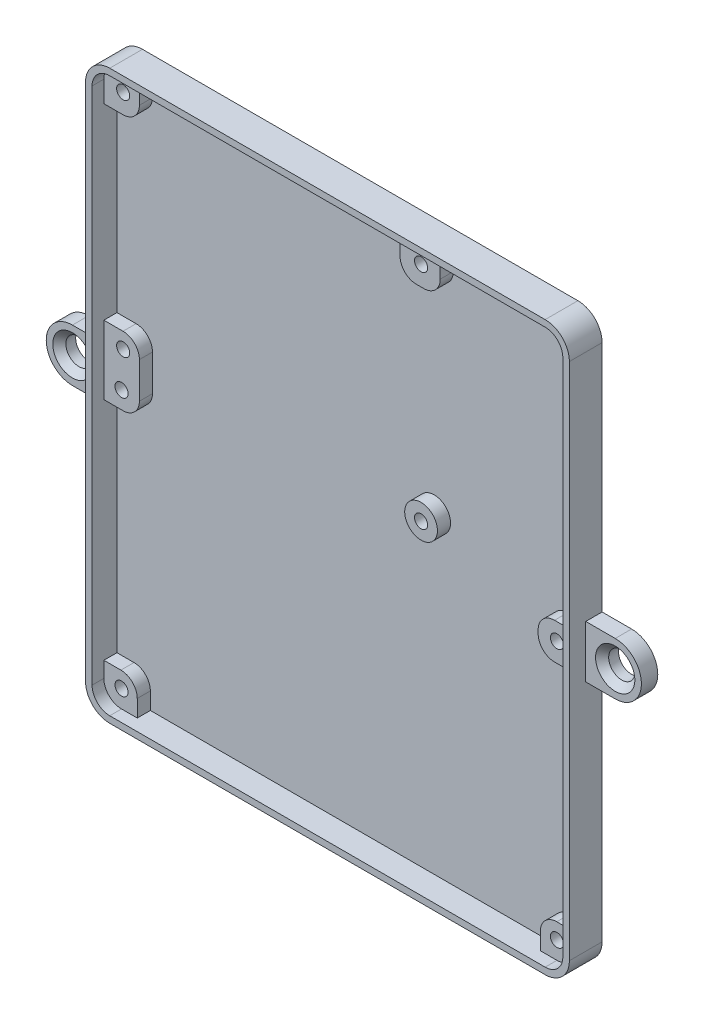
from build123d import *

# Parameters (mm, degrees)
EXTRUDE_1_DEPTH     = 1.2
EXTRUDE_2_DEPTH     = 5
SKETCH_6_R          = 2.5
EXTRUDE_3_DEPTH     = 2
SKETCH_7_R          = 1
CUT_EXTRUDE_1_DEPTH = 113.237393177
SKETCH_8_R          = 2
EXTRUDE_4_DEPTH     = 2.5
CHAMFER_1_SIZE      = 1


with BuildPart() as part:
    # Эскиз4 → Бобышка-Вытянуть1 (new body)
    with BuildSketch(Plane.XY):
        with BuildLine():
            Line((71.69999924, 81.74999906), (71.70000051, 2.500002823))
            ThreePointArc((71.70000051, 2.500002823), (70.909189394, 0.590811786), (68.99999916, -0.20000127))
            Line((68.99999916, -0.20000127), (2.50000008, -0.20000127))
            ThreePointArc((2.50000008, -0.20000127), (0.590809846, 0.590811786), (-0.20000127, 2.500002823))
            Line((-0.20000127, 2.500002823), (-0.2, 81.74999906))
            ThreePointArc((-0.2, 81.74999906), (0.590811714, 83.659187426), (2.50000008, 84.44999914))
            Line((2.50000008, 84.44999914), (68.99999916, 84.44999914))
            ThreePointArc((68.99999916, 84.44999914), (70.909187526, 83.659187426), (71.69999924, 81.74999906))
        make_face()
    extrude(amount=EXTRUDE_1_DEPTH)

    # Эскиз5 → Бобышка-Вытянуть2 (add)
    with BuildSketch(Plane.XY):
        with BuildLine():
            Line((-1.2, 81.74999906), (-1.20000127, 2.500002839))
            ThreePointArc((-1.20000127, 2.500002839), (-0.116296941, -0.116294989), (2.50000008, -1.20000127))
            Line((2.50000008, -1.20000127), (68.99999916, -1.20000127))
            ThreePointArc((68.99999916, -1.20000127), (71.616296534, -0.116294636), (72.70000051, 2.500003839))
            Line((72.70000051, 2.500003839), (72.69999924, 81.749999076))
            ThreePointArc((72.69999924, 81.749999076), (71.616294301, 84.366294213), (68.99999916, 85.44999914))
            Line((68.99999916, 85.44999914), (2.50000008, 85.44999914))
            ThreePointArc((2.50000008, 85.44999914), (-0.116295067, 84.366294207), (-1.2, 81.74999906))
        make_face()
        with BuildLine():
            Line((-0.2, 81.74999906), (-0.20000127, 2.500002823))
            ThreePointArc((-0.20000127, 2.500002823), (0.590809846, 0.590811786), (2.50000008, -0.20000127))
            Line((2.50000008, -0.20000127), (68.99999916, -0.20000127))
            ThreePointArc((68.99999916, -0.20000127), (70.909189394, 0.590811786), (71.70000051, 2.500002823))
            Line((71.70000051, 2.500002823), (71.69999924, 81.74999906))
            ThreePointArc((71.69999924, 81.74999906), (70.909187526, 83.659187426), (68.99999916, 84.44999914))
            Line((68.99999916, 84.44999914), (2.50000008, 84.44999914))
            ThreePointArc((2.50000008, 84.44999914), (0.590811714, 83.659187426), (-0.2, 81.74999906))
        make_face(mode=Mode.SUBTRACT)
    extrude(amount=EXTRUDE_2_DEPTH)

    # Эскиз6 → Бобышка-Вытянуть3 (add)
    with BuildSketch(Plane.XY.offset(1.2)):
        with Locations((48.25000002, 47.49999898)):
            Circle(SKETCH_6_R)
        with BuildLine():
            Line((2.50000008, 84.44999914), (5.226059178, 84.44999914))
            Line((5.226059178, 84.44999914), (5.226059178, 81.007828318))
            ThreePointArc((5.226059178, 81.007828318), (4.493826131, 79.240061365), (2.726059178, 78.507828318))
            Line((2.726059178, 78.507828318), (-0.200000052, 78.507828318))
            Line((-0.200000052, 78.507828318), (-0.2, 81.74999906))
            ThreePointArc((-0.2, 81.74999906), (0.590811714, 83.659187426), (2.50000008, 84.44999914))
        make_face()
        with BuildLine():
            Line((-0.20000127, 2.500002823), (-0.200001232, 4.890114712))
            Line((-0.200001232, 4.890114712), (2.403331994, 4.890114712))
            ThreePointArc((2.403331994, 4.890114712), (4.171098947, 4.157881665), (4.903331994, 2.390114712))
            Line((4.903331994, 2.390114712), (4.903331994, -0.20000127))
            Line((4.903331994, -0.20000127), (2.50000008, -0.20000127))
            ThreePointArc((2.50000008, -0.20000127), (0.590809846, 0.590811786), (-0.20000127, 2.500002823))
        make_face()
        with BuildLine():
            Line((-0.200000511, 49.872119205), (2.726059178, 49.872119205))
            ThreePointArc((2.726059178, 49.872119205), (4.493826131, 49.139886157), (5.226059178, 47.372119205))
            Line((5.226059178, 47.372119205), (5.226059178, 41.864390239))
            ThreePointArc((5.226059178, 41.864390239), (4.493826131, 40.096623286), (2.726059178, 39.364390239))
            Line((2.726059178, 39.364390239), (-0.200000511, 39.364390239))
            Line((-0.200000511, 39.364390239), (-0.200000511, 49.872119205))
        make_face()
        with BuildLine():
            Line((68.99999916, -0.20000127), (66.469541981, -0.20000127))
            Line((66.469541981, -0.20000127), (66.469541981, 2.390114712))
            ThreePointArc((66.469541981, 2.390114712), (67.201775029, 4.157881665), (68.969541981, 4.890114712))
            Line((68.969541981, 4.890114712), (71.700000472, 4.890114712))
            Line((71.700000472, 4.890114712), (71.70000051, 2.500002823))
            ThreePointArc((71.70000051, 2.500002823), (70.909189394, 0.590811786), (68.99999916, -0.20000127))
        make_face()
        with BuildLine():
            Line((45.035976698, 84.44999914), (51.177915607, 84.44999914))
            Line((51.177915607, 84.44999914), (51.177915607, 80.986834439))
            ThreePointArc((51.177915607, 80.986834439), (50.44568256, 79.219067486), (48.677915607, 78.486834439))
            Line((48.677915607, 78.486834439), (47.535976698, 78.486834439))
            ThreePointArc((47.535976698, 78.486834439), (45.768209745, 79.219067486), (45.035976698, 80.986834439))
            Line((45.035976698, 80.986834439), (45.035976698, 84.44999914))
        make_face()
        with BuildLine():
            Line((71.699999835, 44.598653312), (68.631763305, 44.598653312))
            ThreePointArc((68.631763305, 44.598653312), (66.863996352, 43.866420264), (66.131763305, 42.098653312))
            Line((66.131763305, 42.098653312), (66.131763305, 41.579341714))
            ThreePointArc((66.131763305, 41.579341714), (66.863996352, 39.811574761), (68.631763305, 39.079341714))
            Line((68.631763305, 39.079341714), (71.699999835, 39.079341714))
            Line((71.699999835, 39.079341714), (71.699999835, 44.598653312))
        make_face()
    extrude(amount=EXTRUDE_3_DEPTH)

    # Эскиз7 → Вырез-Вытянуть1 (cut, through all)
    with BuildSketch(Plane.XY.offset(3.2)):
        with Locations((2.74999958, 81.49999956)):
            Circle(SKETCH_7_R)
        with Locations((48.25000002, 81.49999956)):
            Circle(SKETCH_7_R)
        with Locations((48.25000002, 47.49999898)):
            Circle(SKETCH_7_R)
        with Locations((68.99999916, 41.99999982)):
            Circle(SKETCH_7_R)
        with Locations((2.74999958, 47.49999898)):
            Circle(SKETCH_7_R)
        with Locations((2.50000008, 41.99999982)):
            Circle(SKETCH_7_R)
        with Locations((2.50000008, 2.50000008)):
            Circle(SKETCH_7_R)
        with Locations((68.99999916, 2.50000008)):
            Circle(SKETCH_7_R)
    extrude(amount=-CUT_EXTRUDE_1_DEPTH, mode=Mode.SUBTRACT)

    # Эскиз8 → Бобышка-Вытянуть4 (add)
    # profile 1 of 2: a face of its own
    with BuildSketch(Plane.XY):
        with BuildLine():
            Line((-5.700000635, 46.12500095), (-1.200000571, 46.12500095))
            Line((-1.200000571, 46.12500095), (-1.200000699, 38.12500095))
            Line((-1.200000699, 38.12500095), (-5.700000635, 38.12500095))
            ThreePointArc((-5.700000635, 38.12500095), (-9.700000635, 42.12500095), (-5.700000635, 46.12500095))
        make_face()
        with Locations((-5.700000635, 42.12500095)):
            Circle(SKETCH_8_R, mode=Mode.SUBTRACT)
    # profile 2 of 2: a face of its own
    with BuildSketch(Plane.XY):
        with BuildLine():
            Line((72.699999939, 38.12500095), (77.199999875, 38.12500095))
            ThreePointArc((77.199999875, 38.12500095), (81.199999875, 42.12500095), (77.199999875, 46.12500095))
            Line((77.199999875, 46.12500095), (72.699999811, 46.12500095))
            Line((72.699999811, 46.12500095), (72.699999939, 38.12500095))
        make_face()
        with Locations(Location((77.199999875, 42.12500095, 0), (0, 0, 180))):
            Circle(SKETCH_8_R, mode=Mode.SUBTRACT)
    extrude(amount=EXTRUDE_4_DEPTH)

    # Фаска1
    chamfer_1_edges = [part.edges().sort_by_distance(p)[0] for p in [
        (-7.700000635, 42.12500095, 2.5),
        (79.199999875, 42.12500095, 2.5),
    ]]
    chamfer(chamfer_1_edges, length=CHAMFER_1_SIZE)


solid = part.part
